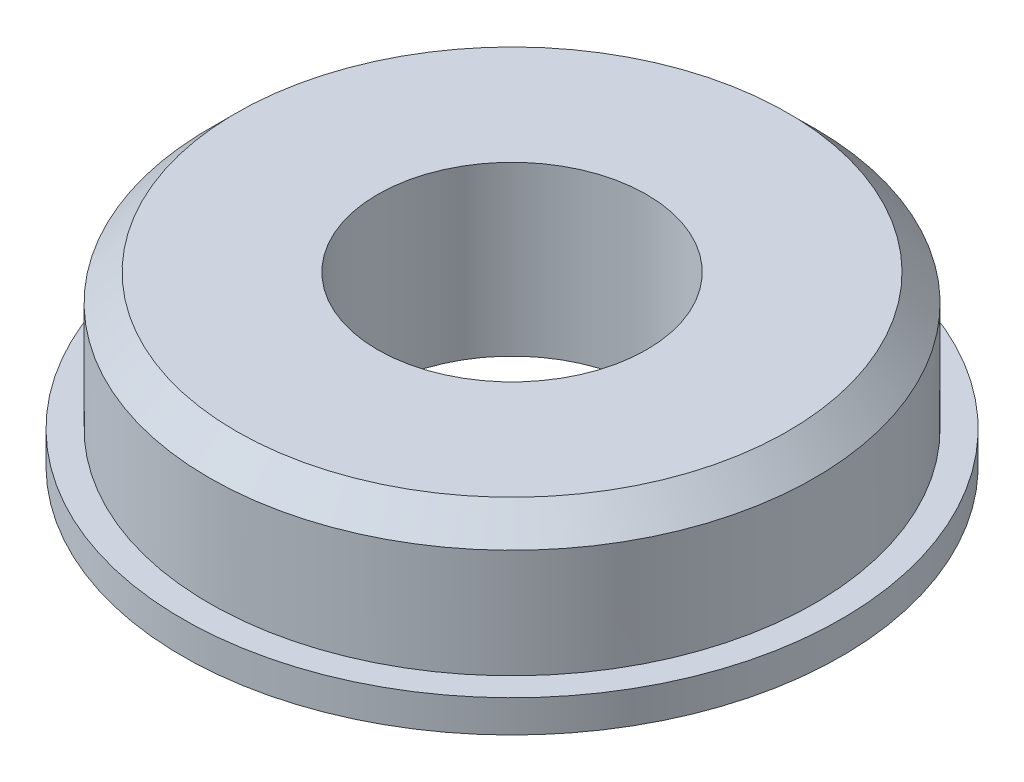
from build123d import *

# Parameters (mm, degrees)
SKETCH1_R           = 14.2875
SKETCH1_R_2         = 6.35
BOSS_EXTRUDE1_DEPTH = 7.9248
CHAMFER1_SIZE       = 1.27
SKETCH2_R           = 15.5575
SKETCH2_R_2         = 6.35
BOSS_EXTRUDE2_DEPTH = 1.524


with BuildPart() as part:
    # Sketch1 → Boss-Extrude1 (new body)
    with BuildSketch(Plane(origin=(0, 0, 0), x_dir=(1, 0, 0), z_dir=(0, 1, 0))):
        with Locations(Location((0, 0, 0), (0, 0, 270))):
            Circle(SKETCH1_R)
        with Locations(Location((0, 0, 0), (0, 0, 270))):
            Circle(SKETCH1_R_2, mode=Mode.SUBTRACT)
    extrude(amount=BOSS_EXTRUDE1_DEPTH)

    # Chamfer1
    chamfer1_edges = [part.edges().sort_by_distance(p)[0] for p in [
        (0, 7.9248, -14.2875),
    ]]
    chamfer(chamfer1_edges, length=CHAMFER1_SIZE)

    # Sketch2 → Boss-Extrude2 (add)
    with BuildSketch(Plane.XZ):
        with Locations(Location((0, 0, 0), (0, 0, 270))):
            Circle(SKETCH2_R)
        with Locations(Location((0, 0, 0), (0, 0, 90))):
            Circle(SKETCH2_R_2, mode=Mode.SUBTRACT)
    extrude(amount=-BOSS_EXTRUDE2_DEPTH)


solid = part.part
